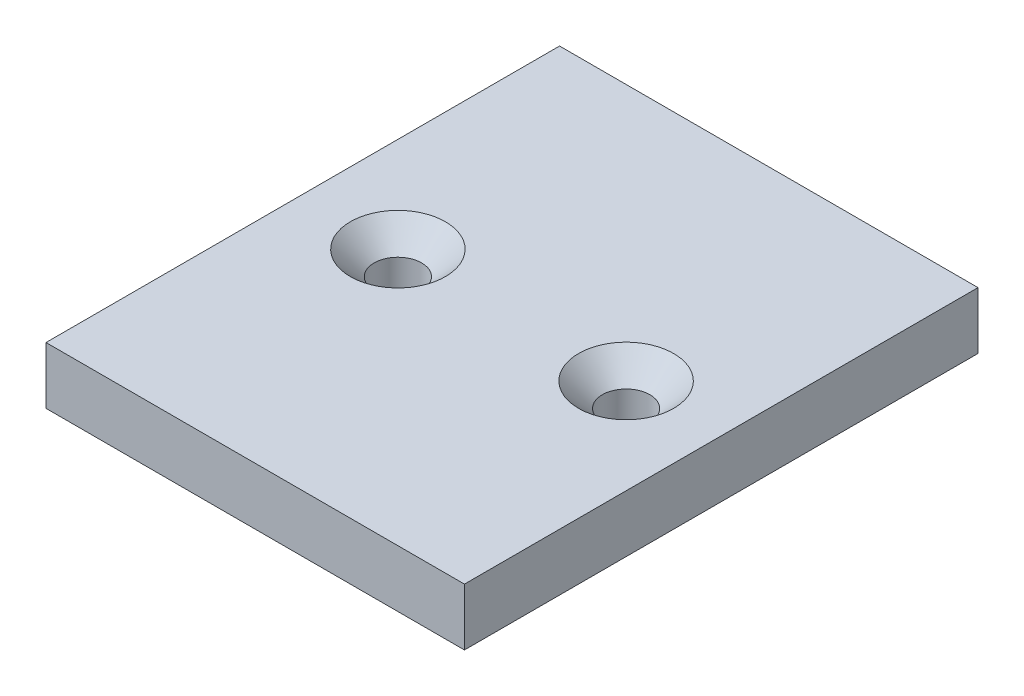
from build123d import *

# Parameters (mm, degrees)
SKETCH1_W                                       = 44
SKETCH1_H                                       = 6
EXTRUDE1_DEPTH                                  = 27
CSK_FOR_M6_FLAT_HEAD_MACHINE_SCREW1_D           = 5
CSK_FOR_M6_FLAT_HEAD_MACHINE_SCREW1_CSINK_D     = 10
CSK_FOR_M6_FLAT_HEAD_MACHINE_SCREW1_CSINK_ANGLE = 90


with BuildPart() as part:
    # Sketch1 → Extrude1 (new, symmetric)
    with BuildSketch(Plane.XY):
        with Locations((22, 3)):
            Rectangle(SKETCH1_W, SKETCH1_H)
    extrude(amount=EXTRUDE1_DEPTH, both=True)

    # CSK for M6 Flat Head Machine Screw1 (through all)
    with Locations(Plane(origin=(10, 6, 0), x_dir=(0, 0, 1), z_dir=(0, 1, 0))):
        with Locations((0, 0), (0, 24)):
            CounterSinkHole(CSK_FOR_M6_FLAT_HEAD_MACHINE_SCREW1_D / 2, CSK_FOR_M6_FLAT_HEAD_MACHINE_SCREW1_CSINK_D / 2, counter_sink_angle=CSK_FOR_M6_FLAT_HEAD_MACHINE_SCREW1_CSINK_ANGLE)


solid = part.part
